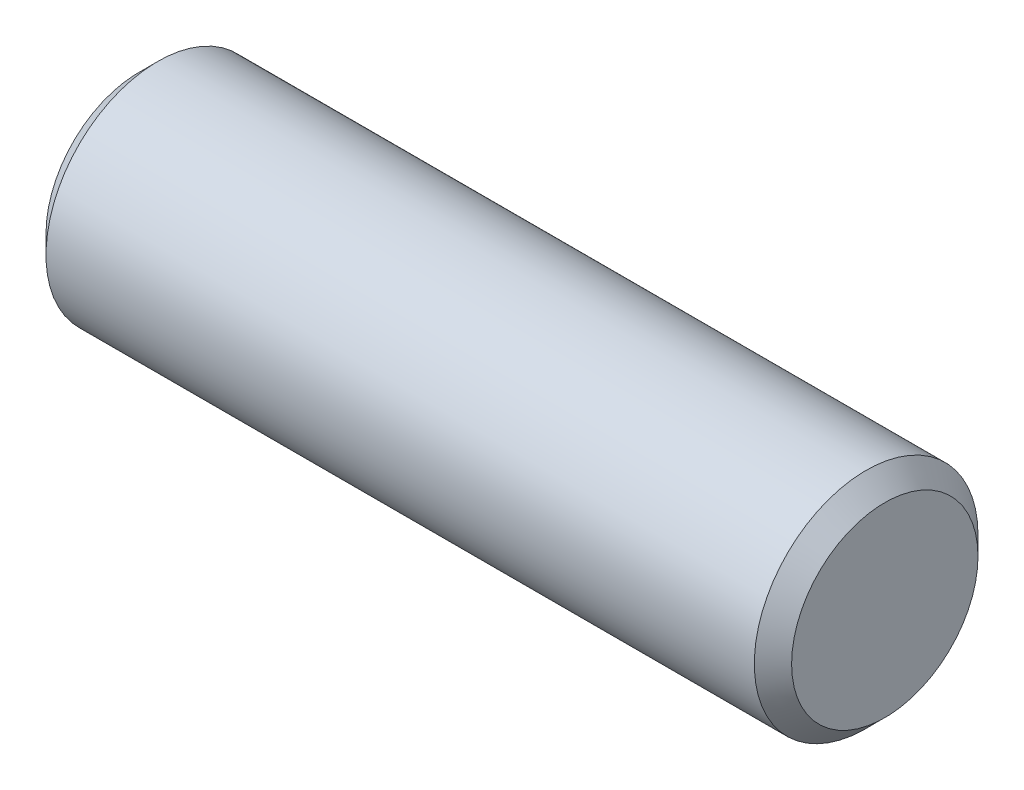
from build123d import *

# Parameters (mm, degrees)
SKETCH1_R           = 1.5
BOSS_EXTRUDE1_DEPTH = 10
CHAMFER1_SIZE       = 0.25


with BuildPart() as part:
    # Sketch1 → Boss-Extrude1 (new body)
    with BuildSketch(Plane(origin=(0, 0, 0), x_dir=(0, 0, -1), z_dir=(1, 0, 0))):
        Circle(SKETCH1_R)
    extrude(amount=BOSS_EXTRUDE1_DEPTH)

    # Chamfer1
    chamfer1_edges = [part.edges().sort_by_distance(p)[0] for p in [
        (0, 0, 1.5),
        (10, 0, 1.5),
    ]]
    chamfer(chamfer1_edges, length=CHAMFER1_SIZE)


solid = part.part
